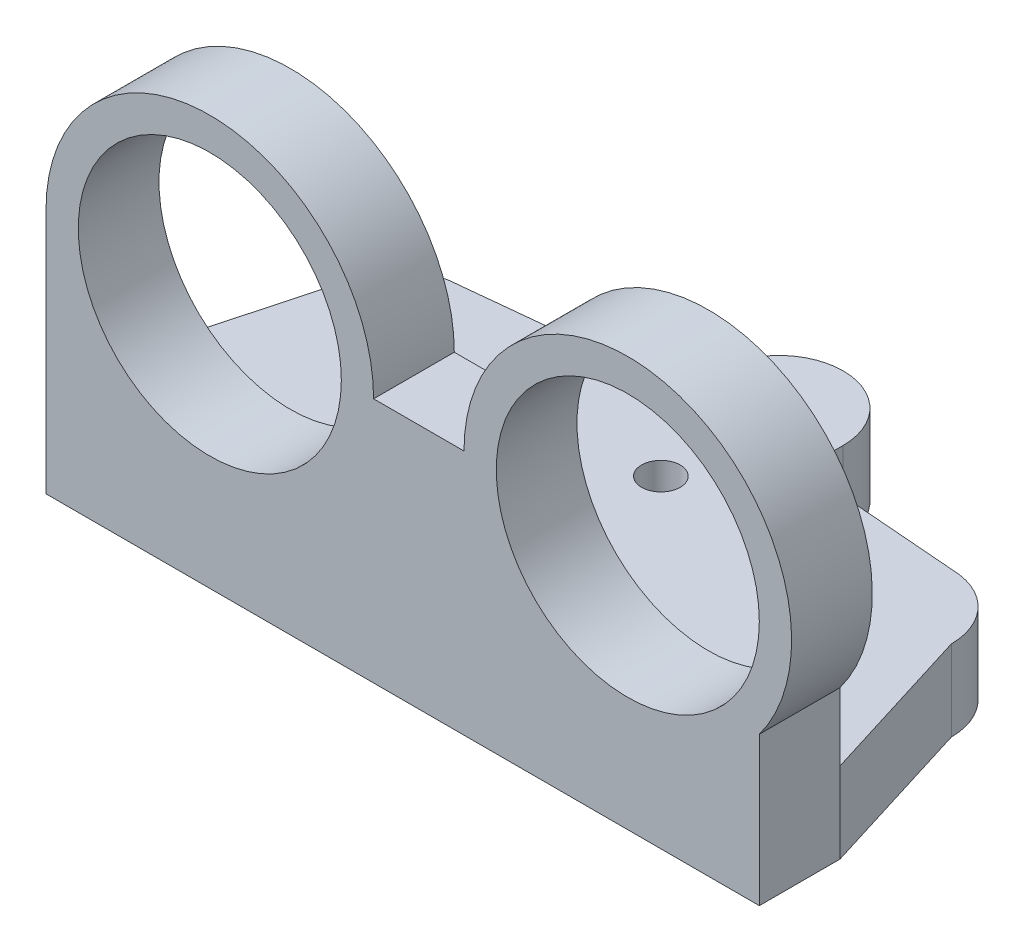
from build123d import *
from build123d.topology import SkipClean

# Parameters (mm, degrees)
BOSS_EXTRUDE1_DEPTH = 3
SKETCH3_R           = 1.2
BOSS_EXTRUDE2_DEPTH = 2
SKETCH6_R           = 8.15
BOSS_EXTRUDE4_DEPTH = 5
BOSS_EXTRUDE5_START = -5
BOSS_EXTRUDE5_DEPTH = 5


with BuildPart() as part:
    # Sketch2 → Boss-Extrude1 (new body)
    with BuildSketch(Plane(origin=(0, 0, 0), x_dir=(1, 0, 0), z_dir=(0, 1, 0))):
        with BuildLine():
            Line((4, -7.3), (4, -4.797924238))
            Line((4, -4.797924238), (14.092577275, -3.998928538))
            ThreePointArc((14.092577275, -3.998928538), (18, 0), (14.092577275, 3.998928538))
            Line((14.092577275, 3.998928538), (4, 4.797924238))
            Line((4, 4.797924238), (4, 7.3))
            ThreePointArc((4, 7.3), (0, 11.3), (-4, 7.3))
            Line((-4, 7.3), (-4, 5.302488085))
            Line((-4, 5.302488085), (-16.521647449, 3.998149809))
            ThreePointArc((-16.521647449, 3.998149809), (-20.4, 0), (-16.521647449, -3.998149809))
            Line((-16.521647449, -3.998149809), (-4, -5.302488085))
            Line((-4, -5.302488085), (-4, -7.3))
            ThreePointArc((-4, -7.3), (0, -11.3), (4, -7.3))
        make_face()
        with BuildLine():
            ThreePointArc((-16.4, -2), (-18.4, 0), (-16.4, 2))
            Line((-16.4, 2), (-2, 3.5))
            Line((-2, 3.5), (-2, 7.3))
            ThreePointArc((-2, 7.3), (0, 9.3), (2, 7.3))
            Line((2, 7.3), (2, 2.95))
            Line((2, 2.95), (14, 2))
            ThreePointArc((14, 2), (16, 0), (14, -2))
            Line((14, -2), (2, -2.95))
            Line((2, -2.95), (2, -7.3))
            ThreePointArc((2, -7.3), (0, -9.3), (-2, -7.3))
            Line((-2, -7.3), (-2, -3.5))
            Line((-2, -3.5), (-16.4, -2))
        make_face(mode=Mode.SUBTRACT)
    extrude(amount=BOSS_EXTRUDE1_DEPTH)

    # Sketch3 → Boss-Extrude2 (add)
    with BuildSketch(Plane(origin=(0, 3, 0), x_dir=(1, 0, 0), z_dir=(0, 1, 0))):
        with BuildLine():
            Line((-4, 5.302488085), (-16.521647449, 3.998149809))
            ThreePointArc((-16.521647449, 3.998149809), (-20.4, 0), (-16.521647449, -3.998149809))
            Line((-16.521647449, -3.998149809), (-4, -5.302488085))
            Line((-4, -5.302488085), (-4, -7.3))
            ThreePointArc((-4, -7.3), (0, -11.3), (4, -7.3))
            Line((4, -7.3), (4, -4.797924238))
            Line((4, -4.797924238), (14.092577275, -3.998928538))
            ThreePointArc((14.092577275, -3.998928538), (18, 0), (14.092577275, 3.998928538))
            Line((14.092577275, 3.998928538), (4, 4.797924238))
            Line((4, 4.797924238), (4, 7.3))
            ThreePointArc((4, 7.3), (0, 11.3), (-4, 7.3))
            Line((-4, 7.3), (-4, 5.302488085))
        make_face()
        with Locations(Location((0, 0, 0), (0, 0, 270))):
            Circle(SKETCH3_R, mode=Mode.SUBTRACT)
    extrude(amount=BOSS_EXTRUDE2_DEPTH)

    # Sketch6 → Boss-Extrude4 (add)
    with BuildSketch(Plane.XY.offset(10)):
        with BuildLine():
            Line((21.1, 5), (21.1, 9.200206615))
            ThreePointArc((21.1, 9.200206615), (16.135906464, 24.887037927), (2.8, 15.25))
            Line((2.8, 15.25), (-2.8, 15.25))
            ThreePointArc((-2.8, 15.25), (-12.95, 25.4), (-23.1, 15.25))
            Line((-23.1, 15.25), (-23.1, 5))
            Line((-23.1, 5), (21.1, 5))
        make_face()
        with Locations((-12.95, 15.25)):
            Circle(SKETCH6_R, mode=Mode.SUBTRACT)
        with Locations((12.95, 15.25)):
            Circle(SKETCH6_R, mode=Mode.SUBTRACT)
    extrude(amount=BOSS_EXTRUDE4_DEPTH)

    # Sketch8 → Boss-Extrude5 (add)
    with SkipClean():  # the faces are left unmerged after this step: merging them gives an invalid solid
        with BuildSketch(Plane(origin=(0, 5, 0), x_dir=(1, 0, 0), z_dir=(0, 1, 0)).offset(BOSS_EXTRUDE5_START)):
            with BuildLine():
                ThreePointArc((-16.521647449, -3.998149809), (-19.271113878, -2.785086193), (-20.4, 0))
                Line((-20.4, 0), (-23.1, -10))
                Line((-23.1, -10), (-2.951270913, -10))
                ThreePointArc((-2.951270913, -10), (-3.728611246, -8.748260396), (-4, -7.3))
                Line((-4, -7.3), (-4, -5.302488085))
                Line((-4, -5.302488085), (-16.521647449, -3.998149809))
            make_face()
            with BuildLine():
                ThreePointArc((4, -7.3), (3.728611246, -8.748260396), (2.951270913, -10))
                Line((2.951270913, -10), (21.1, -10))
                Line((21.1, -10), (18, 0))
                ThreePointArc((18, 0), (16.860970911, -2.795504507), (14.092577275, -3.998928538))
                Line((14.092577275, -3.998928538), (4, -4.797924238))
                Line((4, -4.797924238), (4, -7.3))
            make_face()
            with BuildLine():
                ThreePointArc((-2.951270913, -10), (0, -11.3), (2.951270913, -10))
                Line((2.951270913, -10), (21.1, -10))
                Line((21.1, -10), (21.1, -15))
                Line((21.1, -15), (-23.1, -15))
                Line((-23.1, -15), (-23.1, -10))
                Line((-23.1, -10), (-2.951270913, -10))
            make_face()
        extrude(amount=BOSS_EXTRUDE5_DEPTH)


solid = part.part
